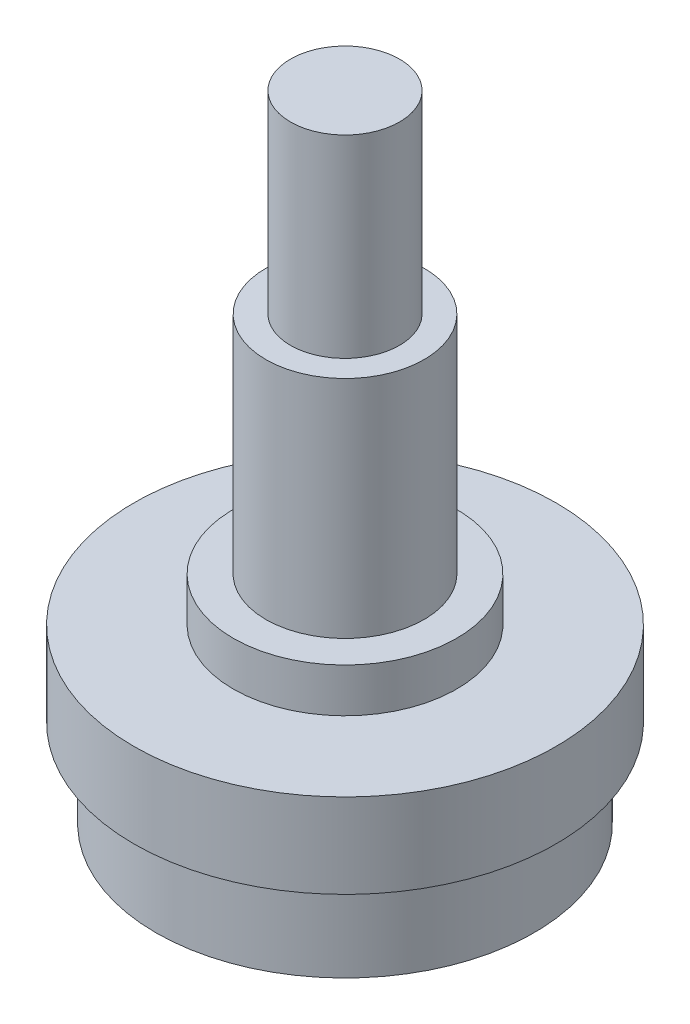
from build123d import *

# Parameters (mm, degrees)
SKETCH1_R           = 10.75
BOSS_EXTRUDE1_DEPTH = 5
SKETCH2_R           = 12
BOSS_EXTRUDE2_DEPTH = 4.8
SKETCH3_R           = 6.35
BOSS_EXTRUDE3_DEPTH = 2.5
SKETCH4_R           = 4.5
BOSS_EXTRUDE4_DEPTH = 12.8
SKETCH6_R           = 3.1
BOSS_EXTRUDE5_DEPTH = 11


with BuildPart() as part:
    # Sketch1 → Boss-Extrude1 (new body)
    with BuildSketch(Plane(origin=(0, 0, 0), x_dir=(1, 0, 0), z_dir=(0, 1, 0))):
        with Locations(Location((0, 0, 0), (0, 0, 270))):
            Circle(SKETCH1_R)
    extrude(amount=BOSS_EXTRUDE1_DEPTH)

    # Sketch2 → Boss-Extrude2 (add)
    with BuildSketch(Plane(origin=(0, 5, 0), x_dir=(1, 0, 0), z_dir=(0, 1, 0))):
        with Locations(Location((0, 0, 0), (0, 0, 270))):
            Circle(SKETCH2_R)
    extrude(amount=BOSS_EXTRUDE2_DEPTH)

    # Sketch3 → Boss-Extrude3 (add)
    with BuildSketch(Plane(origin=(0, 9.8, 0), x_dir=(1, 0, 0), z_dir=(0, 1, 0))):
        with Locations(Location((0, 0, 0), (0, 0, 270))):
            Circle(SKETCH3_R)
    extrude(amount=BOSS_EXTRUDE3_DEPTH)

    # Sketch4 → Boss-Extrude4 (add)
    with BuildSketch(Plane(origin=(0, 12.3, 0), x_dir=(1, 0, 0), z_dir=(0, 1, 0))):
        with Locations(Location((0, 0, 0), (0, 0, 270))):
            Circle(SKETCH4_R)
    extrude(amount=BOSS_EXTRUDE4_DEPTH)

    # Sketch6 → Boss-Extrude5 (add)
    with BuildSketch(Plane(origin=(0, 25.1, 0), x_dir=(1, 0, 0), z_dir=(0, 1, 0))):
        with Locations(Location((0, 0, 0), (0, 0, 270))):
            Circle(SKETCH6_R)
    extrude(amount=BOSS_EXTRUDE5_DEPTH)


solid = part.part
